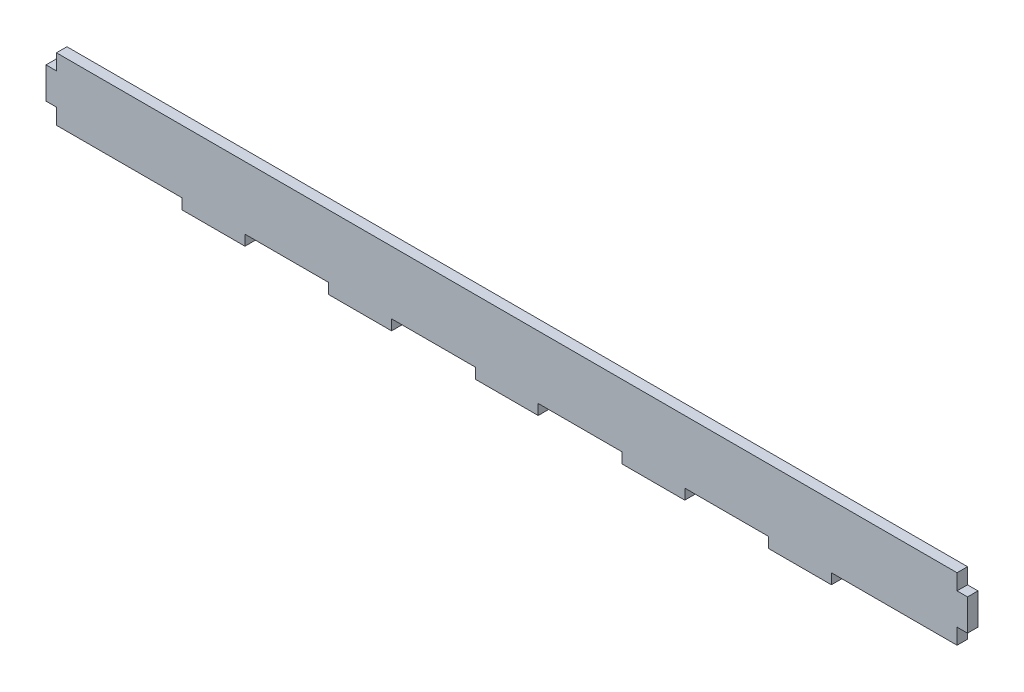
from build123d import *

# Parameters (mm, degrees)
BOSS_EXTRUDE1_DEPTH = 5


with BuildPart() as part:
    # Sketch1 → Boss-Extrude1 (new body)
    with BuildSketch(Plane.XY):
        Polygon((440.000271395, -430), (440.000271395, -422.5), (445, -422.5), (445, -407.5), (440.000271395, -407.5), (440.000271395, -400), (9.999728605, -400), (9.999728605, -407.5), (5, -407.5), (5, -422.5), (9.999728605, -422.5), (9.999728605, -430), (70, -430), (70, -435), (100, -435), (100, -430), (140, -430), (140, -435), (170, -435), (170, -430), (210, -430), (210, -435), (240, -435), (240, -430), (280, -430), (280, -435), (310, -435), (310, -430), (350, -430), (350, -435), (380, -435), (380, -430), align=None)
    extrude(amount=-BOSS_EXTRUDE1_DEPTH)


solid = part.part
